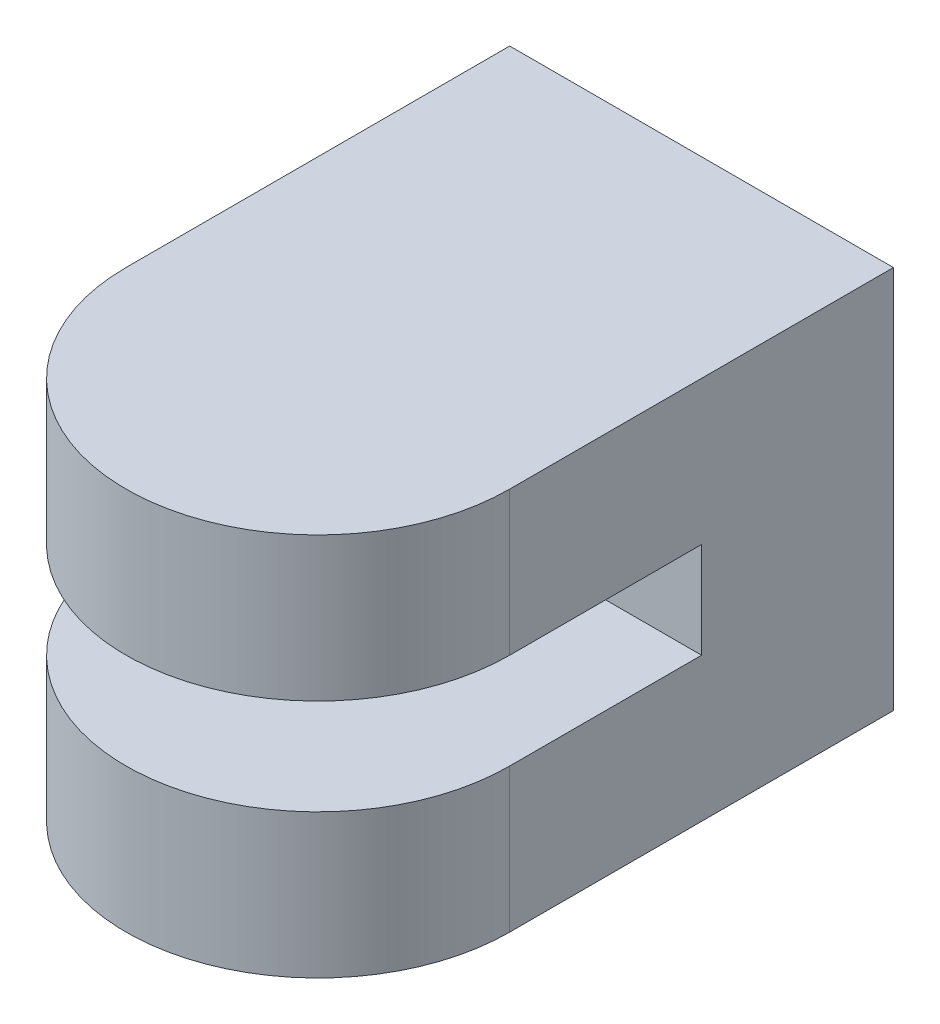
from build123d import *

# Parameters (mm, degrees)
AUFSATZ_LINEAR_AUSTRAGEN1_DEPTH      = 10
SCHNITT_LINEAR_AUSTRAGEN1_DEPTH      = 25.494897428
SCHNITT_LINEAR_AUSTRAGEN1_DEPTH_BACK = 10
SKIZZE2_W                            = 20
SKIZZE2_H                            = 5


with BuildPart() as part:
    # Skizze1 → Aufsatz-Linear austragen1 (new, symmetric)
    with BuildSketch(Plane(origin=(0, 0, 0), x_dir=(1, 0, 0), z_dir=(0, 1, 0))):
        with BuildLine():
            Line((-10, 0), (-10, 20))
            Line((-10, 20), (10, 20))
            Line((10, 20), (10, 0))
            ThreePointArc((10, 0), (0, -10), (-10, 0))
        make_face()
    extrude(amount=AUFSATZ_LINEAR_AUSTRAGEN1_DEPTH, both=True)

    # Skizze2 → Schnitt-Linear austragen1 (cut, two sides: drawn at the far end of the back side and taken through both)
    with BuildSketch(Plane.XY.offset(-SCHNITT_LINEAR_AUSTRAGEN1_DEPTH_BACK)):
        Rectangle(SKIZZE2_W, SKIZZE2_H)
    extrude(amount=SCHNITT_LINEAR_AUSTRAGEN1_DEPTH + SCHNITT_LINEAR_AUSTRAGEN1_DEPTH_BACK, mode=Mode.SUBTRACT)


solid = part.part
